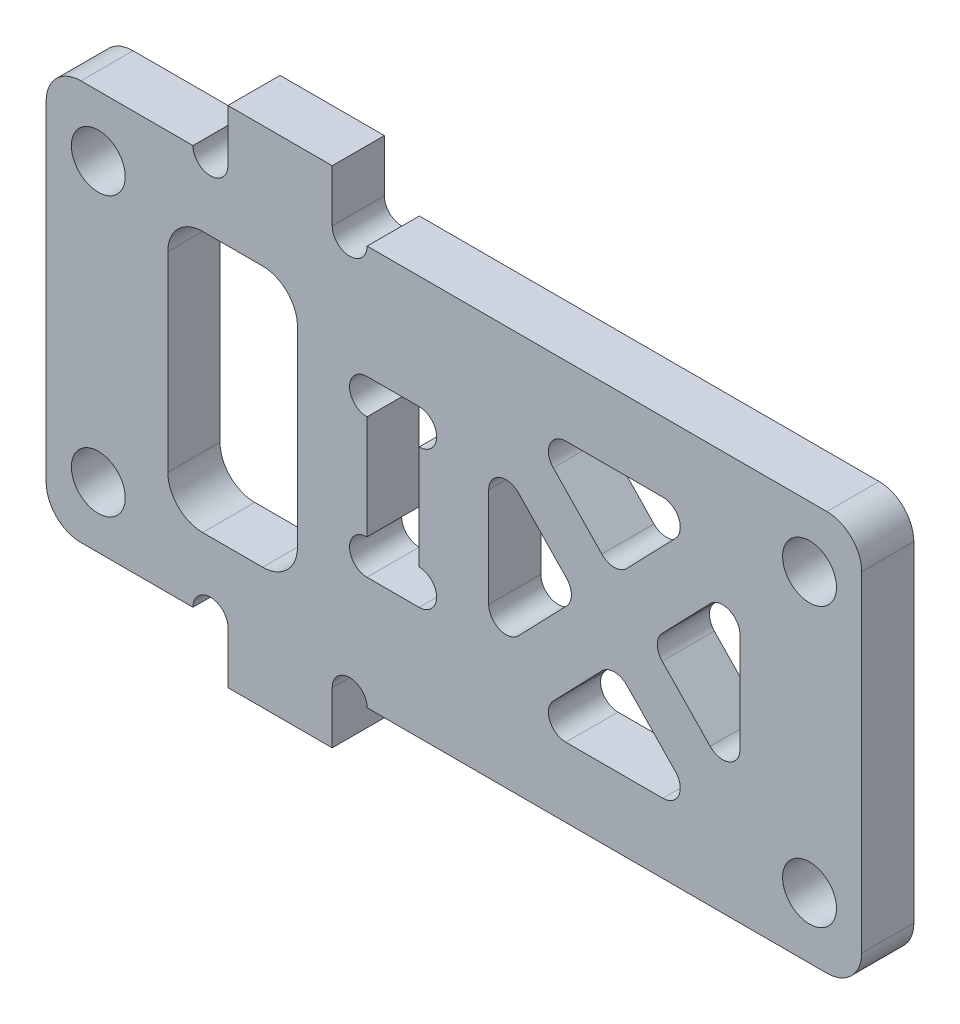
from build123d import *

# Parameters (mm, degrees)
SKETCH_1_R      = 1.55
SKETCH_1_W      = 7.455
SKETCH_1_H      = 15
EXTRUDE_1_DEPTH = 3
FILLET_1_R      = 2
FILLET_2_R      = 1


with BuildPart() as part:
    # 草图1 → 凸台-拉伸1 (new body)
    with BuildSketch(Plane.XY):
        with BuildLine():
            Line((-13, 14.5), (-13, 11.5))
            ThreePointArc((-13, 11.5), (-14.005, 10.495), (-15.01, 11.5))
            Line((-15.01, 11.5), (-23.455, 11.5))
            Line((-23.455, 11.5), (-23.455, -11.5))
            Line((-23.455, -11.5), (-15.01, -11.5))
            ThreePointArc((-15.01, -11.5), (-14.005, -10.495), (-13, -11.5))
            Line((-13, -11.5), (-13, -14.5))
            Line((-13, -14.5), (-7, -14.5))
            Line((-7, -14.5), (-7, -11.5))
            ThreePointArc((-7, -11.5), (-5.995, -10.495), (-4.99, -11.5))
            Line((-4.99, -11.5), (23.455, -11.5))
            Line((23.455, -11.5), (23.455, 11.5))
            Line((23.455, 11.5), (-4.99, 11.5))
            ThreePointArc((-4.99, 11.5), (-5.995, 10.495), (-7, 11.5))
            Line((-7, 11.5), (-7, 14.5))
            Line((-7, 14.5), (-13, 14.5))
        make_face()
        with Locations((-20.455, -8)):
            Circle(SKETCH_1_R, mode=Mode.SUBTRACT)
        with Locations((20.455, -8)):
            Circle(SKETCH_1_R, mode=Mode.SUBTRACT)
        Polygon((9.2275, -2.161680579), (14.371860482, -7.5), (4.083139518, -7.5), align=None, mode=Mode.SUBTRACT)
        with Locations((-12.7275, 0)):
            Rectangle(SKETCH_1_W, SKETCH_1_H, mode=Mode.SUBTRACT)
        with BuildLine():
            ThreePointArc((-0.995, -3.995), (-1.289357685, -4.705642315), (-2, -5))
            Line((-2, -5), (-5, -5))
            ThreePointArc((-5, -5), (-6.005, -3.995), (-5, -2.99))
            Line((-5, -2.99), (-5, 2.99))
            ThreePointArc((-5, 2.99), (-6.005, 3.995), (-5, 5))
            Line((-5, 5), (-2, 5))
            ThreePointArc((-2, 5), (-1.289357685, 4.705642315), (-0.995, 3.995))
            ThreePointArc((-0.995, 3.995), (-1.289357685, 3.284357685), (-2, 2.99))
            Line((-2, 2.99), (-2, -2.99))
            ThreePointArc((-2, -2.99), (-1.289357685, -3.284357685), (-0.995, -3.995))
        make_face(mode=Mode.SUBTRACT)
        with Locations((-20.455, 8)):
            Circle(SKETCH_1_R, mode=Mode.SUBTRACT)
        Polygon((2, -5.338319421), (2, 5.338319421), (7.144360482, 0), align=None, mode=Mode.SUBTRACT)
        Polygon((4.083139518, 7.5), (14.371860482, 7.5), (9.2275, 2.161680579), align=None, mode=Mode.SUBTRACT)
        Polygon((11.310639518, 0), (16.455, 5.338319421), (16.455, -5.338319421), align=None, mode=Mode.SUBTRACT)
        with Locations((20.455, 8)):
            Circle(SKETCH_1_R, mode=Mode.SUBTRACT)
    extrude(amount=EXTRUDE_1_DEPTH)

    # 圆角1
    fillet_1_edges = [part.edges().sort_by_distance(p)[0] for p in [
        (-23.455, -11.5, 1.5),
        (-23.455, 11.5, 1.5),
        (23.455, 11.5, 1.5),
        (23.455, -11.5, 1.5),
        (-16.455, -7.5, 1.5),
        (-9, -7.5, 1.5),
        (-9, 7.5, 1.5),
        (-16.455, 7.5, 1.5),
    ]]
    fillet(fillet_1_edges, radius=FILLET_1_R)

    # 圆角2
    fillet_2_edges = [part.edges().sort_by_distance(p)[0] for p in [
        (16.455, -5.338319421, 1.5),
        (16.455, 5.338319421, 1.5),
        (11.310639518, 0, 1.5),
        (14.371860482, -7.5, 1.5),
        (9.2275, -2.161680579, 1.5),
        (4.083139518, -7.5, 1.5),
        (2, 5.338319421, 1.5),
        (2, -5.338319421, 1.5),
        (7.144360482, 0, 1.5),
        (14.371860482, 7.5, 1.5),
        (4.083139518, 7.5, 1.5),
        (9.2275, 2.161680579, 1.5),
    ]]
    fillet(fillet_2_edges, radius=FILLET_2_R)


solid = part.part
